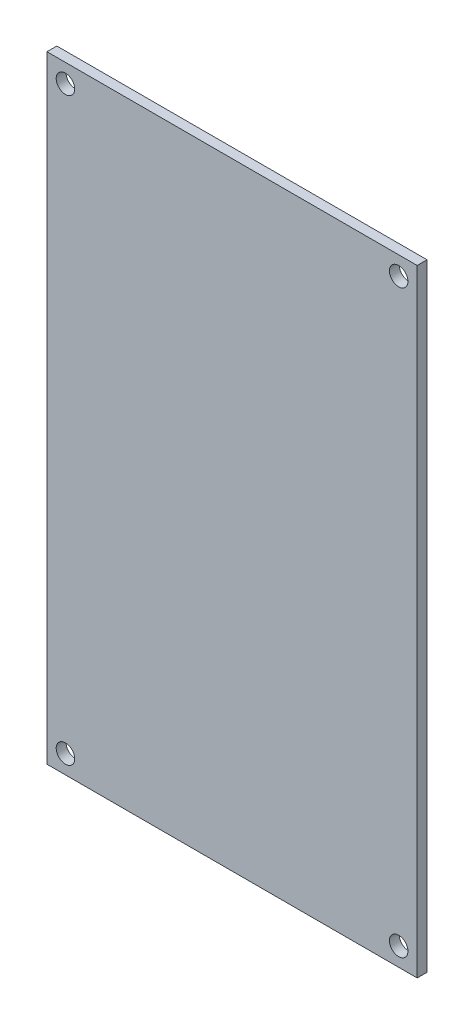
from build123d import *

# Parameters (mm, degrees)
SKETCH_1_W      = 60
SKETCH_1_H      = 100
SKETCH_1_R      = 1.5
EXTRUDE_1_DEPTH = 1.6


with BuildPart() as part:
    # 草图1 → 凸台-拉伸1 (new body)
    with BuildSketch(Plane.XY):
        with Locations((30, 50)):
            Rectangle(SKETCH_1_W, SKETCH_1_H)
        with Locations((3, 3)):
            Circle(SKETCH_1_R, mode=Mode.SUBTRACT)
        with Locations((57, 3)):
            Circle(SKETCH_1_R, mode=Mode.SUBTRACT)
        with Locations((57, 97)):
            Circle(SKETCH_1_R, mode=Mode.SUBTRACT)
        with Locations((3, 97)):
            Circle(SKETCH_1_R, mode=Mode.SUBTRACT)
    extrude(amount=EXTRUDE_1_DEPTH)


solid = part.part
